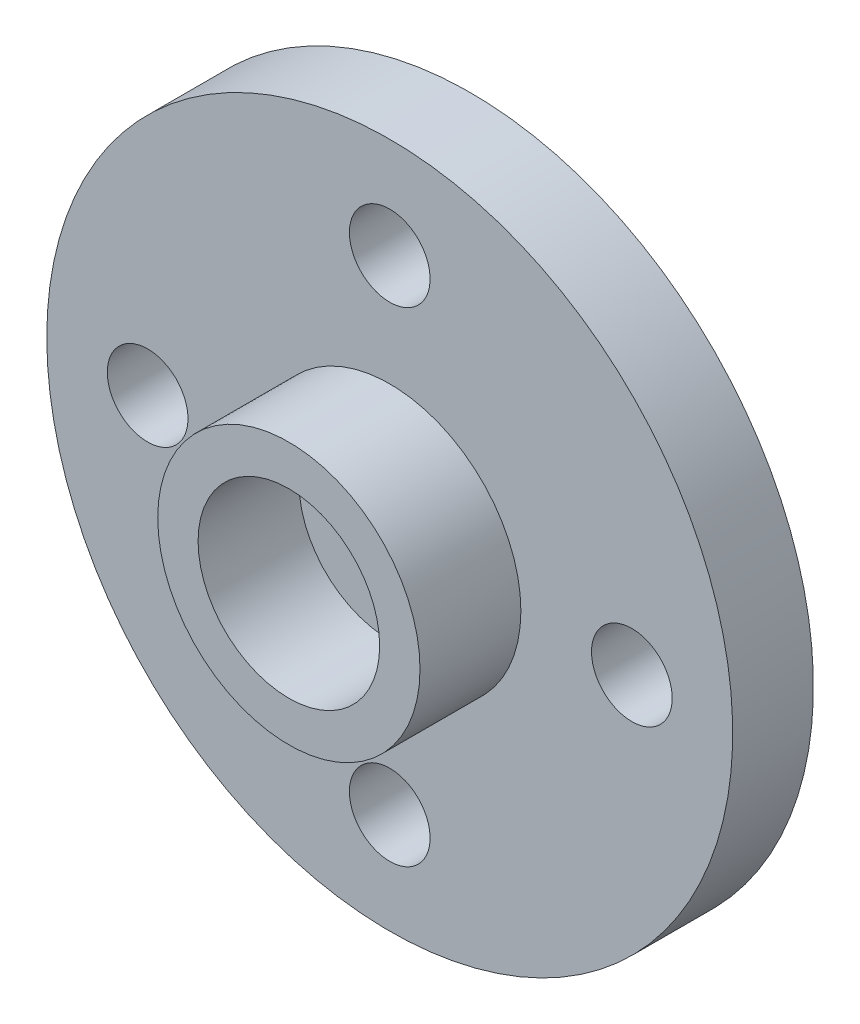
from build123d import *

# Parameters (mm, degrees)
SKETCH1_R           = 3.25
SKETCH1_R_2         = 2.25
BOSS_EXTRUDE1_DEPTH = 4.5
SKETCH2_R           = 8.5
SKETCH2_R_2         = 0.85
SKETCH2_R_3         = 1
BOSS_EXTRUDE2_DEPTH = 2


with BuildPart() as part:
    # Sketch1 → Boss-Extrude1 (new body)
    with BuildSketch(Plane.XY):
        Circle(SKETCH1_R)
        Circle(SKETCH1_R_2, mode=Mode.SUBTRACT)
    extrude(amount=BOSS_EXTRUDE1_DEPTH)

    # Sketch2 → Boss-Extrude2 (add)
    with BuildSketch(Plane(origin=(0, 0, 0), x_dir=(-1, 0, 0), z_dir=(0, 0, -1))):
        Circle(SKETCH2_R)
        Circle(SKETCH2_R_2, mode=Mode.SUBTRACT)
        with Locations((-6, 0)):
            Circle(SKETCH2_R_3, mode=Mode.SUBTRACT)
        with Locations((0, 6)):
            Circle(SKETCH2_R_3, mode=Mode.SUBTRACT)
        with Locations((6, 0)):
            Circle(SKETCH2_R_3, mode=Mode.SUBTRACT)
        with Locations((0, -6)):
            Circle(SKETCH2_R_3, mode=Mode.SUBTRACT)
    extrude(amount=-BOSS_EXTRUDE2_DEPTH)


solid = part.part
